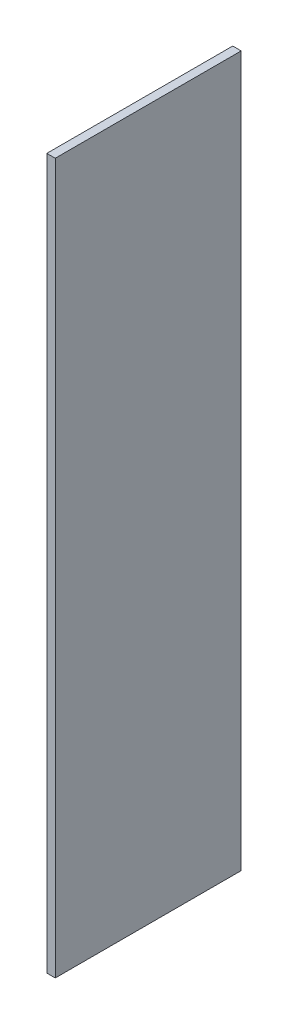
from build123d import *

# Parameters (mm, degrees)
SKETCH2_W           = 25.4
SKETCH2_H           = 558.8
BOSS_EXTRUDE1_DEPTH = 2133.6


with BuildPart() as part:
    # Sketch2 → Boss-Extrude1 (new body)
    with BuildSketch(Plane(origin=(0, 0, 0), x_dir=(1, 0, 0), z_dir=(0, 1, 0))):
        Rectangle(SKETCH2_W, SKETCH2_H)
    extrude(amount=BOSS_EXTRUDE1_DEPTH)


solid = part.part
